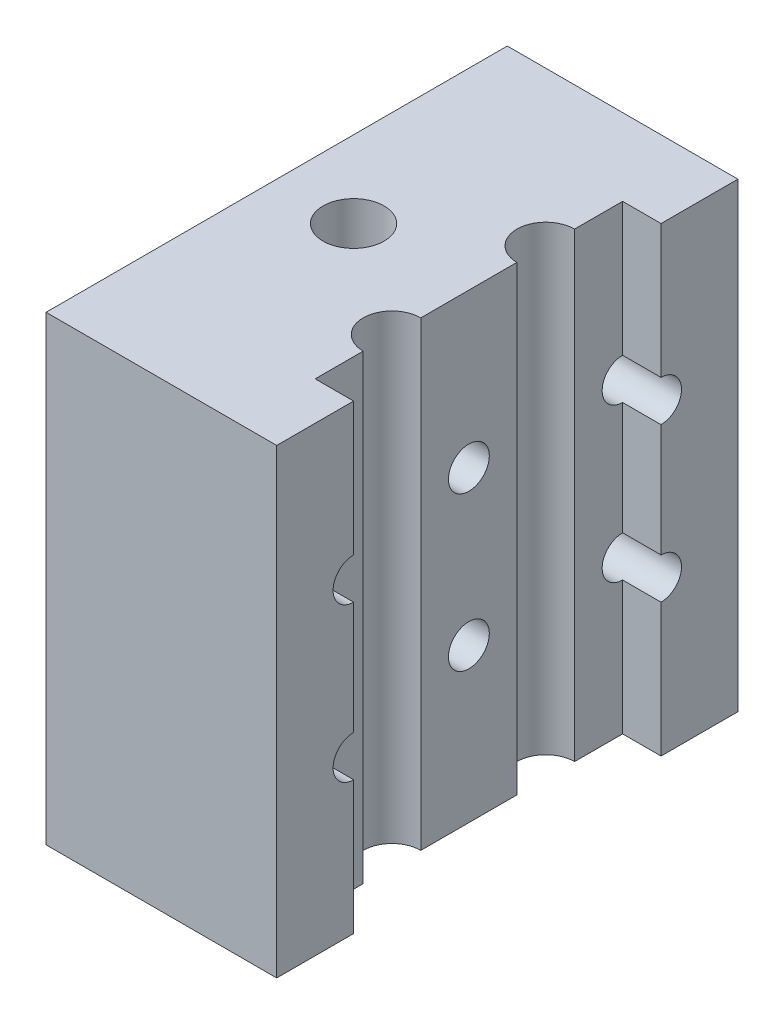
from build123d import *

# Parameters (mm, degrees)
SKETCH1_W               = 38.1
SKETCH1_H               = 76.2
BOSS_EXTRUDE1_DEPTH     = 76.2
SKETCH2_W               = 6.35
SKETCH2_H               = 50.8
CUT_EXTRUDE1_DEPTH      = 94.3255592
F_1_4_CLEARANCE_HOLE1_D = 6.7564
F_3_8_CLEARANCE_HOLE1_D = 10.0838
SKETCH7_R               = 4.7625
CUT_EXTRUDE2_DEPTH      = 94.325559323


with BuildPart() as part:
    # Sketch1 → Boss-Extrude1 (new body)
    with BuildSketch(Plane(origin=(0, 0, 0), x_dir=(1, 0, 0), z_dir=(0, 1, 0))):
        with Locations((-19.05, 0)):
            Rectangle(SKETCH1_W, SKETCH1_H)
    extrude(amount=BOSS_EXTRUDE1_DEPTH)

    # Sketch2 → Cut-Extrude1 (cut, through all)
    with BuildSketch(Plane(origin=(0, 76.2, 0), x_dir=(1, 0, 0), z_dir=(0, 1, 0))):
        with Locations((-3.175, 0)):
            Rectangle(SKETCH2_W, SKETCH2_H)
    extrude(amount=-CUT_EXTRUDE1_DEPTH, mode=Mode.SUBTRACT)

    # 1/4 Clearance Hole1 (through all)
    with Locations(Plane(origin=(0, 0, 0), x_dir=(0, 0, -1), z_dir=(1, 0, 0))):
        with Locations((0, 50.8), (0, 25.4), (-25.4, 25.4), (-25.4, 50.8), (25.4, 50.8), (25.4, 25.4)):
            Hole(F_1_4_CLEARANCE_HOLE1_D / 2)

    # 3/8 Clearance Hole1 (through all)
    with Locations(Plane(origin=(0, 76.2, 0), x_dir=(1, 0, 0), z_dir=(0, 1, 0))):
        with Locations((-25.4, 0)):
            Hole(F_3_8_CLEARANCE_HOLE1_D / 2)

    # Sketch7 → Cut-Extrude2 (cut, through all)
    with BuildSketch(Plane(origin=(0, 76.2, 0), x_dir=(1, 0, 0), z_dir=(0, 1, 0))):
        with Locations((-6.35, 12.7)):
            Circle(SKETCH7_R)
        with Locations((-6.35, -12.7)):
            Circle(SKETCH7_R)
    extrude(amount=-CUT_EXTRUDE2_DEPTH, mode=Mode.SUBTRACT)


solid = part.part
